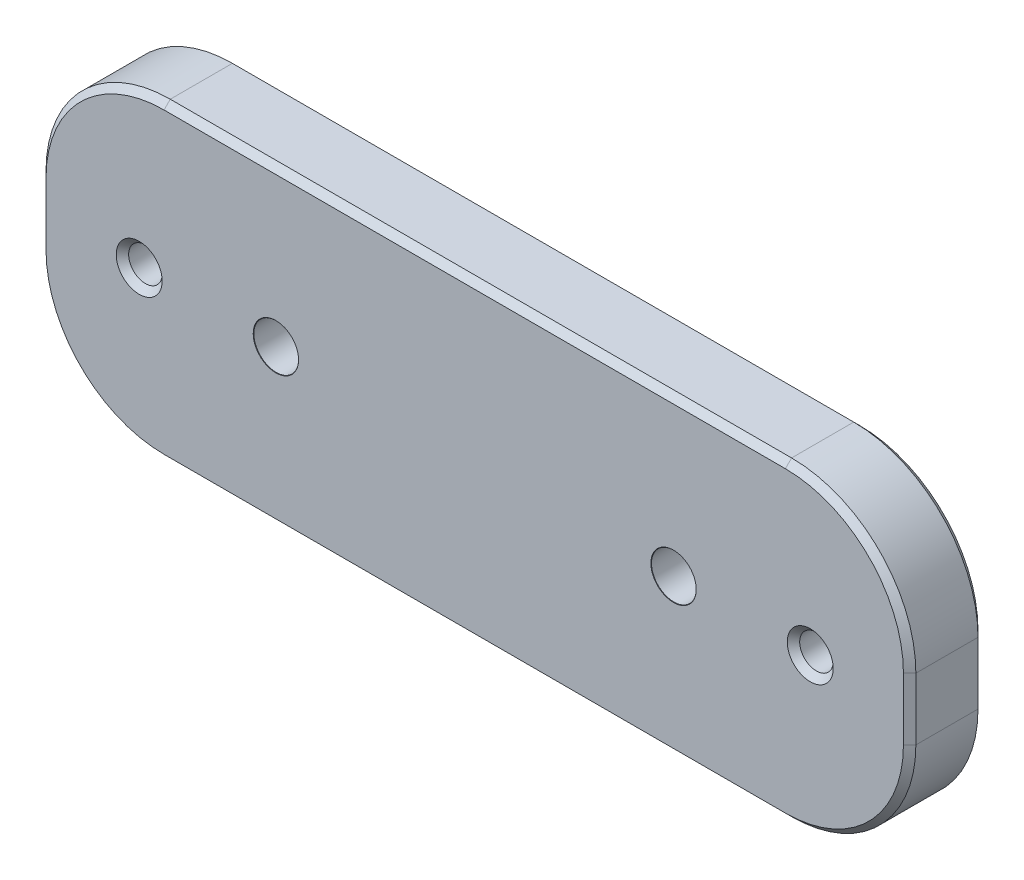
from build123d import *

# Parameters (mm, degrees)
SKETCH1_W                                    = 70
SKETCH1_H                                    = 25
SKETCH1_R                                    = 1.35
BOSS_EXTRUDE1_DEPTH                          = 6
CHAMFER1_SIZE                                = 0.5
FILLET1_R                                    = 10
CHAMFER2_SIZE                                = 0.5
CSK_FOR_M3_COUNTERSUNK_FLAT_HEAD_SCR_2_COUNT = 2
CSK_FOR_M3_COUNTERSUNK_FLAT_HEAD_SCR_2_PITCH = 32


with BuildPart() as part:
    # Sketch1 → Boss-Extrude1 (new body)
    with BuildSketch(Plane.XY):
        Rectangle(SKETCH1_W, SKETCH1_H)
        with Locations((-27, 0)):
            Circle(SKETCH1_R, mode=Mode.SUBTRACT)
        with Locations((27, 0)):
            Circle(SKETCH1_R, mode=Mode.SUBTRACT)
        with Locations((-16, 0)):
            Circle(SKETCH1_R, mode=Mode.SUBTRACT)
        with Locations((16, 0)):
            Circle(SKETCH1_R, mode=Mode.SUBTRACT)
    extrude(amount=BOSS_EXTRUDE1_DEPTH)

    # Chamfer1
    chamfer1_edges = [part.edges().sort_by_distance(p)[0] for p in [
        (-28.35, 0, 0),
        (-28.35, 0, 6),
        (25.65, 0, 0),
        (25.65, 0, 6),
    ]]
    chamfer(chamfer1_edges, length=CHAMFER1_SIZE)

    # Fillet1
    fillet1_edges = [part.edges().sort_by_distance(p)[0] for p in [
        (35, -12.5, 3),
        (-35, -12.5, 3),
        (-35, 12.5, 3),
        (35, 12.5, 3),
    ]]
    fillet(fillet1_edges, radius=FILLET1_R)

    # Chamfer2
    chamfer2_edges = [part.edges().sort_by_distance(p)[0] for p in [
        (-35, 0, 0),
        (-35, 0, 6),
        (35, 0, 0),
        (0, -12.5, 0),
        (0, 12.5, 0),
        (32.071067812, -9.571067812, 0),
        (-32.071067812, -9.571067812, 0),
        (32.071067812, 9.571067812, 0),
        (-32.071067812, 9.571067812, 0),
        (0, 12.5, 6),
        (35, 0, 6),
        (0, -12.5, 6),
        (32.071067812, -9.571067812, 6),
        (-32.071067812, -9.571067812, 6),
        (32.071067812, 9.571067812, 6),
        (-32.071067812, 9.571067812, 6),
    ]]
    chamfer(chamfer2_edges, length=CHAMFER2_SIZE)

    # Sketch3 → CSK for M3 Countersunk Flat Head Screw1 (revolve, cut)
    with BuildSketch(Plane.YZ.offset(-16)):
        Polygon((0, 0), (0, 6), (1.825, 6), (1.8, 5.975), (1.8, 2.35), (4.15, 0), align=None)
    csk_for_m3_countersunk_flat_head_screw1 = revolve(axis=Axis((-16, 0, -6.35), (0, 0, 1)), mode=Mode.SUBTRACT)

    # CSK for M3 Countersunk Flat Head Scr 2: CSK for M3 Countersunk Flat Head Screw1 ×2
    with Locations(*[(i * CSK_FOR_M3_COUNTERSUNK_FLAT_HEAD_SCR_2_PITCH, 0, 0) for i in range(1, CSK_FOR_M3_COUNTERSUNK_FLAT_HEAD_SCR_2_COUNT)]):
        add(csk_for_m3_countersunk_flat_head_screw1, mode=Mode.SUBTRACT)


solid = part.part
